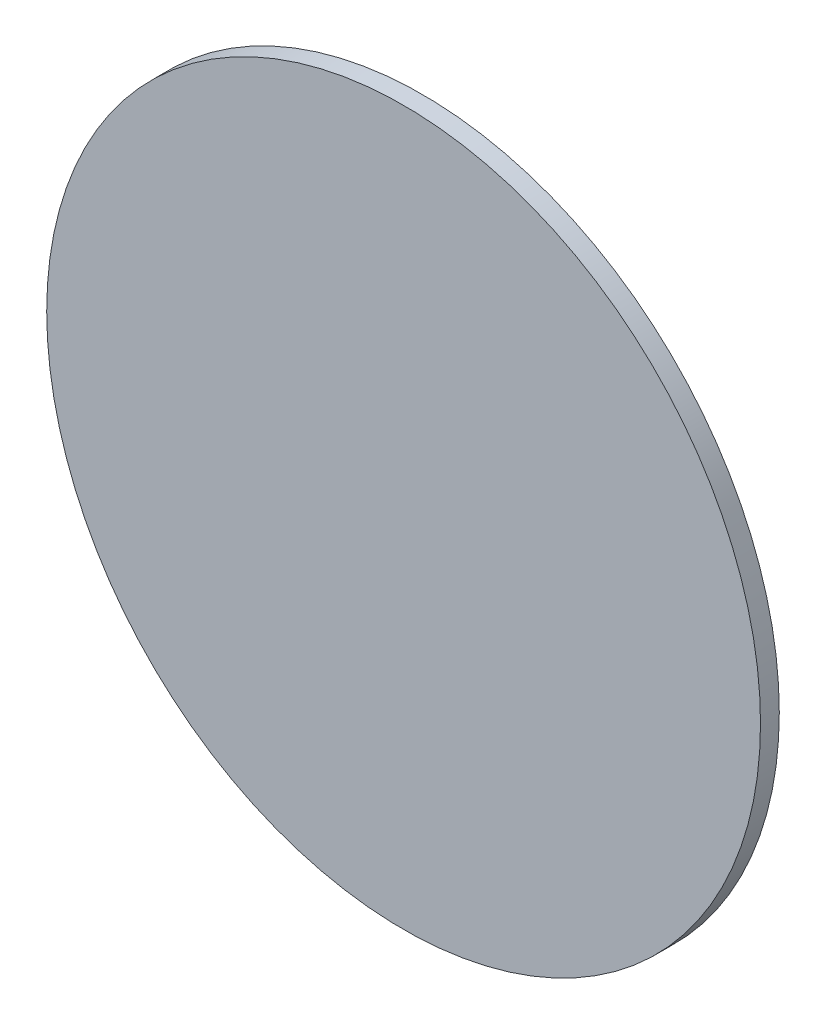
from build123d import *

# Parameters (mm, degrees)
SKETCH_1_R      = 19
EXTRUDE_1_DEPTH = 1


with BuildPart() as part:
    # Эскиз1 → Бобышка-Вытянуть1 (new body)
    with BuildSketch(Plane.XY):
        Circle(SKETCH_1_R)
    extrude(amount=EXTRUDE_1_DEPTH)


solid = part.part
